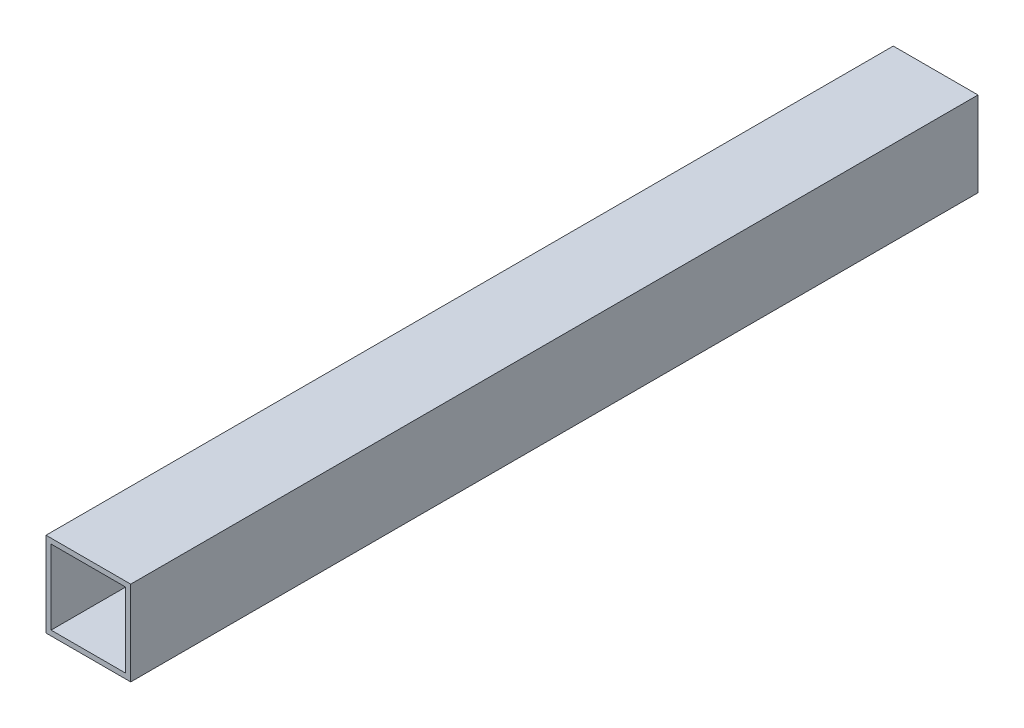
from build123d import *

# Parameters (mm, degrees)
SKETCH_1_W      = 25
SKETCH_1_H      = 25
SKETCH_1_W_2    = 22
SKETCH_1_H_2    = 22
EXTRUDE_1_DEPTH = 250


with BuildPart() as part:
    # Эскиз1 → Вытянуть-Тонкостенный1 (new body)
    with BuildSketch(Plane.XY):
        Rectangle(SKETCH_1_W, SKETCH_1_H)
        Rectangle(SKETCH_1_W_2, SKETCH_1_H_2, mode=Mode.SUBTRACT)
    extrude(amount=EXTRUDE_1_DEPTH)


solid = part.part
